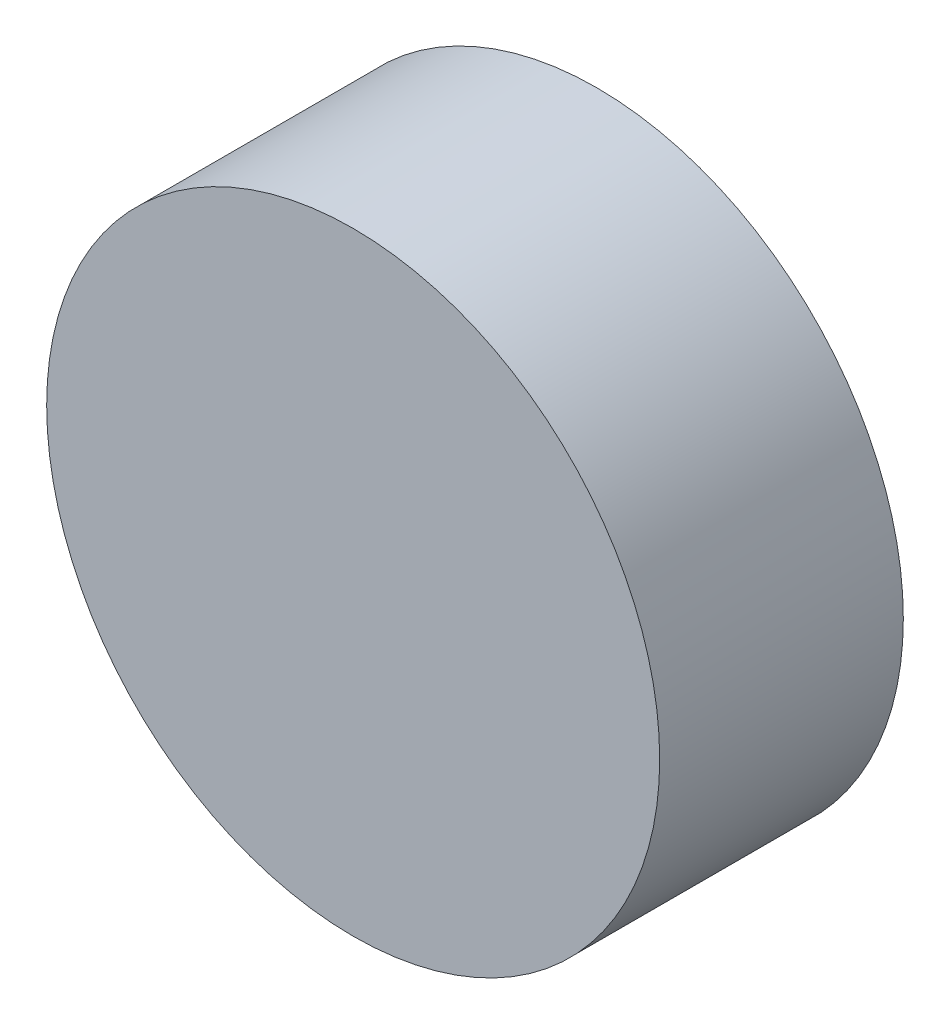
from build123d import *

# Parameters (mm, degrees)
SKETCH1_R           = 29
BOSS_EXTRUDE1_DEPTH = 23.050246


with BuildPart() as part:
    # Sketch1 → Boss-Extrude1 (new body)
    with BuildSketch(Plane.XY):
        Circle(SKETCH1_R)
    extrude(amount=BOSS_EXTRUDE1_DEPTH)


solid = part.part
